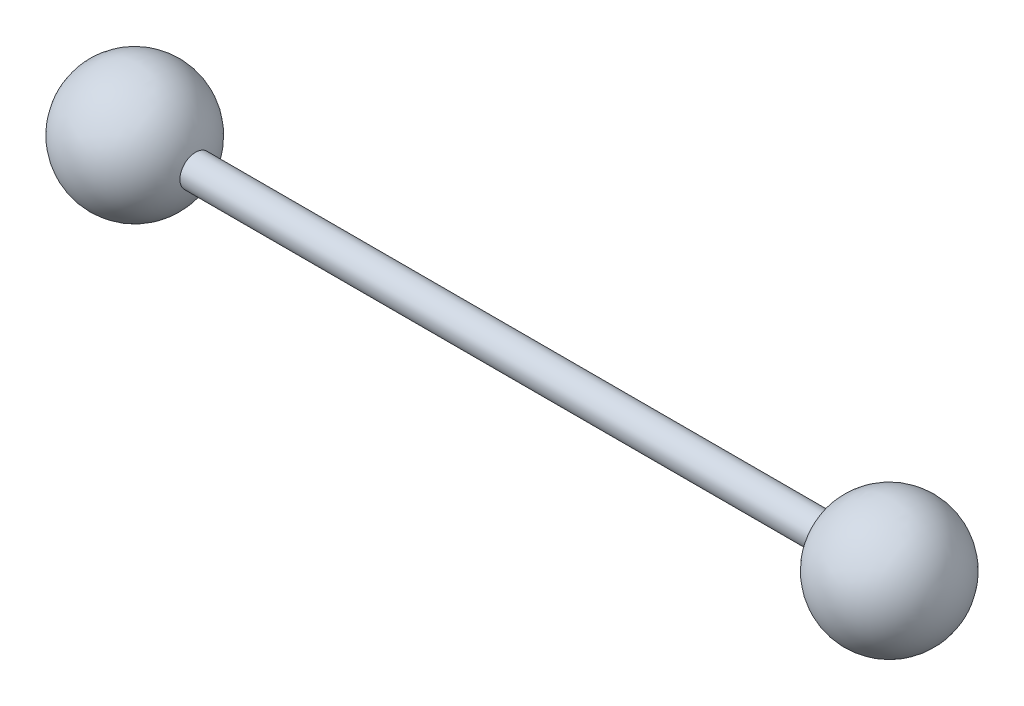
from build123d import *

# Parameters (mm, degrees)
R_P_TITION_LIN_AIRE1_COUNT = 2
R_P_TITION_LIN_AIRE1_PITCH = 120
BOSS_EXTRU_1_REACH         = 132.767
BOSS_EXTRU_1_END_RADIUS    = 10
ESQUISSE2_R                = 2.5


with BuildPart() as part:
    # Esquisse1 → Révolution3 (revolve)
    with BuildSketch(Plane.XY):
        with BuildLine():
            Line((-10, 0), (10, 0))
            ThreePointArc((10, 0), (0, 10), (-10, 0))
        make_face()
    revolve(axis=Axis((-9.638277329, 0, 0), (1, 0, 0)))


with BuildPart() as r_p_tition_lin_aire1_1:
    # Répétition linéaire1: pattern copy
    add(part.part.moved(Location(Vector(1, 0, 0) * (1 * R_P_TITION_LIN_AIRE1_PITCH))))


with BuildPart() as part_1:
    add(part.part)

    add(r_p_tition_lin_aire1_1.part)  # Boss.-Extru.1 merges Répétition linéaire1_1
    # Boss.-Extru.1: up to this sphere (the profile starts outside it)
    boss_extru_1_end = Location((120, 0, 0)) * Sphere(BOSS_EXTRU_1_END_RADIUS, mode=Mode.PRIVATE)
    # Esquisse2 → Boss.-Extru.1 (add, up to the surface)
    with BuildSketch(Plane(origin=(0, 0, 0), x_dir=(0, 0, -1), z_dir=(1, 0, 0)), mode=Mode.PRIVATE) as boss_extru_1_sk1:
        with Locations(Location((0, 0, 0), (0, 0, 180))):
            Circle(ESQUISSE2_R)
    boss_extru_1_tool1 = extrude(boss_extru_1_sk1.sketch, amount=BOSS_EXTRU_1_REACH, mode=Mode.PRIVATE) - boss_extru_1_end
    add(boss_extru_1_tool1.solids().sort_by_distance((0, 0, 0))[0])


solid = part_1.part
